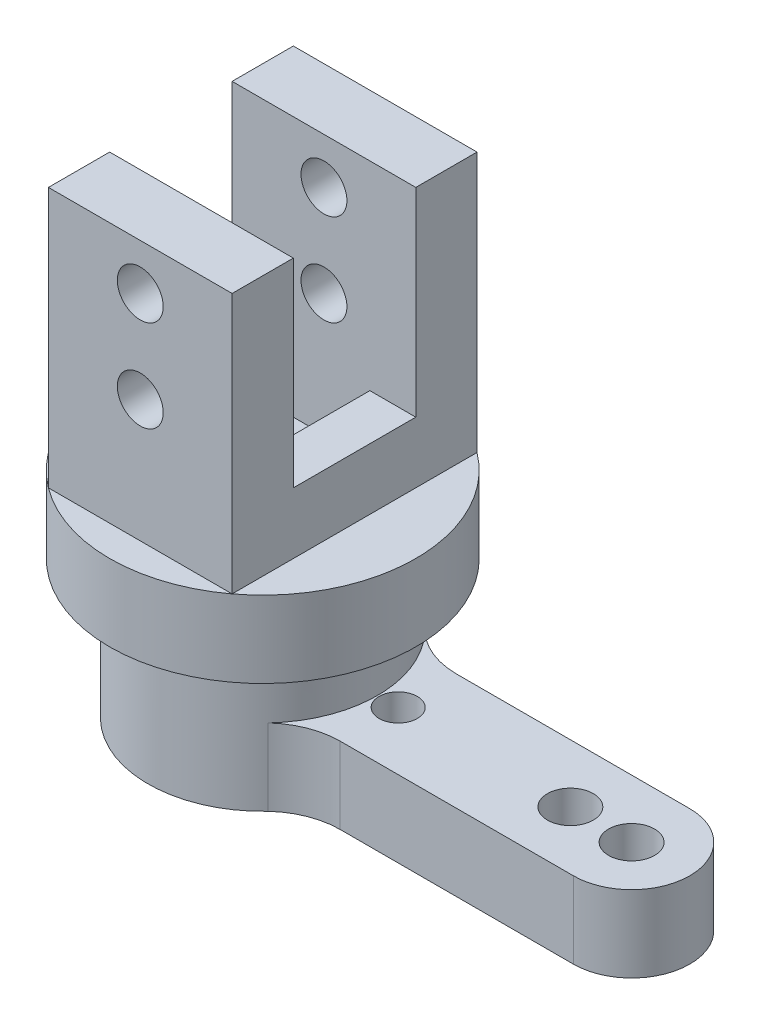
from build123d import *

# Parameters (mm, degrees)
SKETCH3_R                = 1.25
SKETCH3_R_2              = 1.5
BOSS_EXTRUDE9_DEPTH      = 5
SKETCH4_R                = 7.5
BOSS_EXTRUDE10_DEPTH     = 4
SKETCH5_R                = 10
BOSS_EXTRUDE11_DEPTH     = 5
SKETCH6_R                = 1.5
CUT_EXTRUDE1_DEPTH       = 33.778193971
SKETCH7_W                = 12
SKETCH7_H                = 4
BOSS_EXTRUDE12_DEPTH     = 17
SKETCH8_W                = 3
SKETCH8_H                = 8
BOSS_EXTRUDE13_DEPTH     = 4
F_3_0_3_DIAMETER_HOLE1_D = 3


with BuildPart() as part:
    # Sketch3 → Boss-Extrude9 (new body)
    with BuildSketch(Plane(origin=(0, 0, 0), x_dir=(1, 0, 0), z_dir=(0, 1, 0))):
        with BuildLine():
            Line((24.1, 3.8), (8.85, 3.8))
            ThreePointArc((8.85, 3.8), (7.033595607, 4.14837388), (5.468099348, 5.133214346))
            ThreePointArc((5.468099348, 5.133214346), (-7.5, 0), (5.468099348, -5.133214346))
            ThreePointArc((5.468099348, -5.133214346), (7.033595607, -4.14837388), (8.85, -3.8))
            Line((8.85, -3.8), (24.1, -3.8))
            ThreePointArc((24.1, -3.8), (27.9, 0), (24.1, 3.8))
        make_face()
        with Locations((8.85, 0)):
            Circle(SKETCH3_R, mode=Mode.SUBTRACT)
        with Locations((20.1, 0)):
            Circle(SKETCH3_R_2, mode=Mode.SUBTRACT)
        with Locations((24.1, 0)):
            Circle(SKETCH3_R_2, mode=Mode.SUBTRACT)
    extrude(amount=BOSS_EXTRUDE9_DEPTH)

    # Sketch4 → Boss-Extrude10 (add)
    with BuildSketch(Plane(origin=(0, 5, 0), x_dir=(1, 0, 0), z_dir=(0, 1, 0))):
        Circle(SKETCH4_R)
    extrude(amount=BOSS_EXTRUDE10_DEPTH)

    # Sketch5 → Boss-Extrude11 (add)
    with BuildSketch(Plane(origin=(0, 9, 0), x_dir=(1, 0, 0), z_dir=(0, 1, 0))):
        Circle(SKETCH5_R)
    extrude(amount=BOSS_EXTRUDE11_DEPTH)

    # Sketch6 → Cut-Extrude1 (cut, through all)
    with BuildSketch(Plane(origin=(0, 14, 0), x_dir=(1, 0, 0), z_dir=(0, 1, 0))):
        Circle(SKETCH6_R)
    extrude(amount=-CUT_EXTRUDE1_DEPTH, mode=Mode.SUBTRACT)

    # Sketch7 → Boss-Extrude12 (add)
    with BuildSketch(Plane(origin=(0, 14, 0), x_dir=(1, 0, 0), z_dir=(0, 1, 0))):
        with Locations((0, -6)):
            Rectangle(SKETCH7_W, SKETCH7_H)
        with Locations((0, 6)):
            Rectangle(SKETCH7_W, SKETCH7_H)
    extrude(amount=BOSS_EXTRUDE12_DEPTH)

    # Sketch8 → Boss-Extrude13 (add)
    with BuildSketch(Plane(origin=(0, 14, 0), x_dir=(1, 0, 0), z_dir=(0, 1, 0))):
        with Locations((4.5, 0)):
            Rectangle(SKETCH8_W, SKETCH8_H)
        with Locations((-4.5, 0)):
            Rectangle(SKETCH8_W, SKETCH8_H)
    extrude(amount=BOSS_EXTRUDE13_DEPTH)

    # Ø3.0 (3) Diameter Hole1 (through all)
    with Locations(Plane.XY.offset(8)):
        with Locations((0, 28), (0, 22)):
            Hole(F_3_0_3_DIAMETER_HOLE1_D / 2)


solid = part.part
